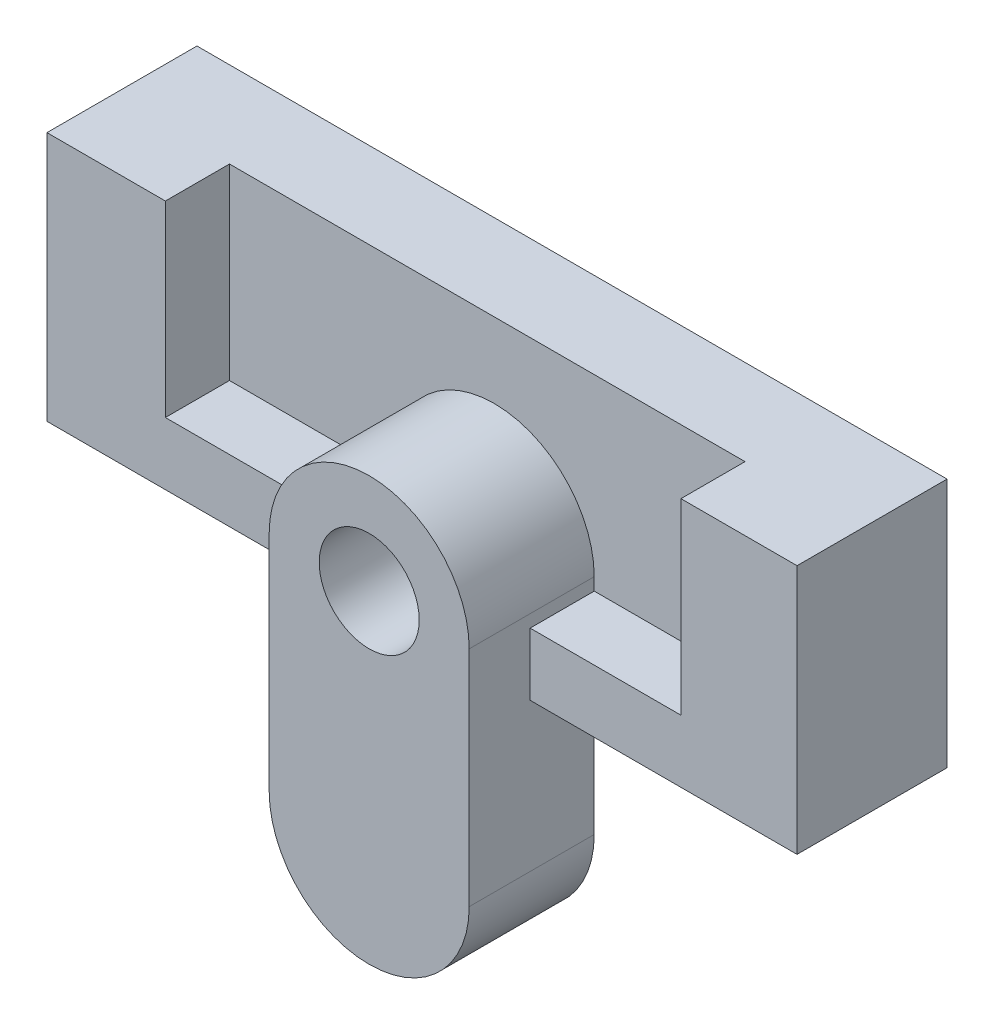
from build123d import *

# Parameters (mm, degrees)
BOSS_EXTRUDE1_DEPTH     = 20
SKETCH2_W               = 60
SKETCH2_H               = 12
BOSS_EXTRUDE2_DEPTH     = 5
SKETCH3_R               = 4
BOSS_EXTRUDE3_DEPTH     = 10
CUT_EXTRUDE1_DEPTH      = 38.939846984
CUT_EXTRUDE1_DEPTH_BACK = 38.939846984
SKETCH3_3_R             = 4


with BuildPart() as part:
    # Sketch1 → Boss-Extrude1 (new body)
    with BuildSketch(Plane(origin=(0, 0, 0), x_dir=(1, 0, 0), z_dir=(0, 1, 0))):
        Polygon((20.061919505, 0.724458204), (29.349845201, 0.724458204), (29.349845201, 12.724458204), (-30.650154799, 12.724458204), (-30.650154799, 0.724458204), (-21.176470588, 0.724458204), (-21.176470588, 5.851393189), (20.061919505, 5.851393189), align=None)
    extrude(amount=BOSS_EXTRUDE1_DEPTH)

    # Sketch2 → Boss-Extrude2 (add)
    with BuildSketch(Plane.XZ):
        with Locations((-0.650154799, -6.724458204)):
            Rectangle(SKETCH2_W, SKETCH2_H)
    extrude(amount=-BOSS_EXTRUDE2_DEPTH)

    # Sketch3 → Boss-Extrude3 (add)
    with BuildSketch(Plane.XY.offset(-5.851393189)):
        with BuildLine():
            Line((8, -11.858632677), (8, 6))
            ThreePointArc((8, 6), (0, 14), (-8, 6))
            Line((-8, 6), (-8, -11.858632677))
            ThreePointArc((-8, -11.858632677), (0, -19.858632677), (8, -11.858632677))
        make_face()
        with Locations((0, 6)):
            Circle(SKETCH3_R, mode=Mode.SUBTRACT)
    extrude(amount=BOSS_EXTRUDE3_DEPTH)

    # Sketch3<3> → Cut-Extrude1 (cut, two sides: drawn at the far end of the back side and taken through both)
    with BuildSketch(Plane.XY.offset(-5.851393189).offset(-CUT_EXTRUDE1_DEPTH_BACK)):
        with Locations((0, 6)):
            Circle(SKETCH3_3_R)
    extrude(amount=CUT_EXTRUDE1_DEPTH + CUT_EXTRUDE1_DEPTH_BACK, mode=Mode.SUBTRACT)


solid = part.part
